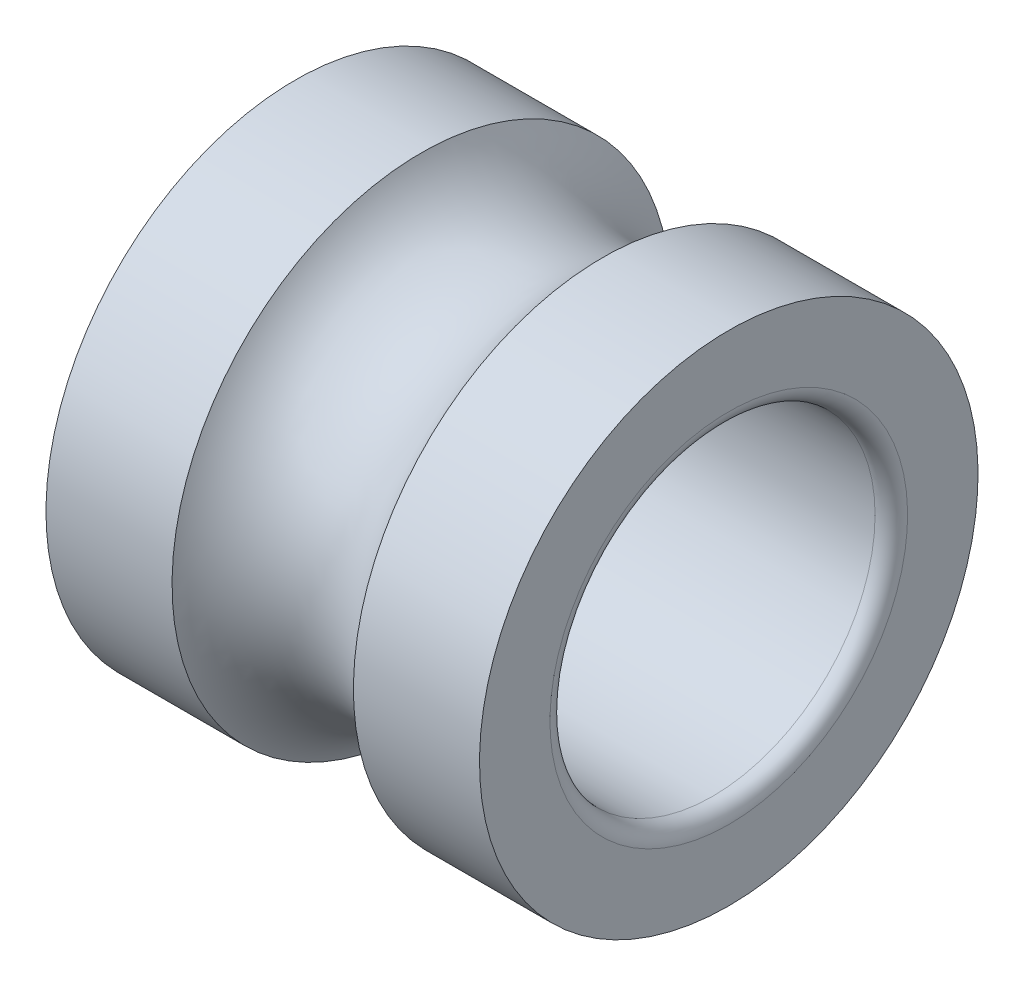
from build123d import *


with BuildPart() as part:
    # Esquisse1 → Révolution1 (revolve)
    with BuildSketch(Plane.XY, mode=Mode.PRIVATE) as r_volution1_sk:
        with BuildLine():
            Line((0.15, 1.5), (3.85, 1.5))
            ThreePointArc((3.85, 1.5), (3.956066017, 1.543933983), (4, 1.65))
            Line((4, 1.65), (4, 2.3))
            Line((4, 2.3), (2.836660027, 2.3))
            ThreePointArc((2.836660027, 2.3), (2, 1.8), (1.163339973, 2.3))
            Line((1.163339973, 2.3), (0, 2.3))
            Line((0, 2.3), (0, 1.65))
            ThreePointArc((0, 1.65), (0.043933983, 1.543933983), (0.15, 1.5))
        make_face()
    revolve(r_volution1_sk.sketch.rotate(Axis((0, 0, 0), (1, 0, 0)), 180), axis=Axis((0, 0, 0), (1, 0, 0)))


solid = part.part
